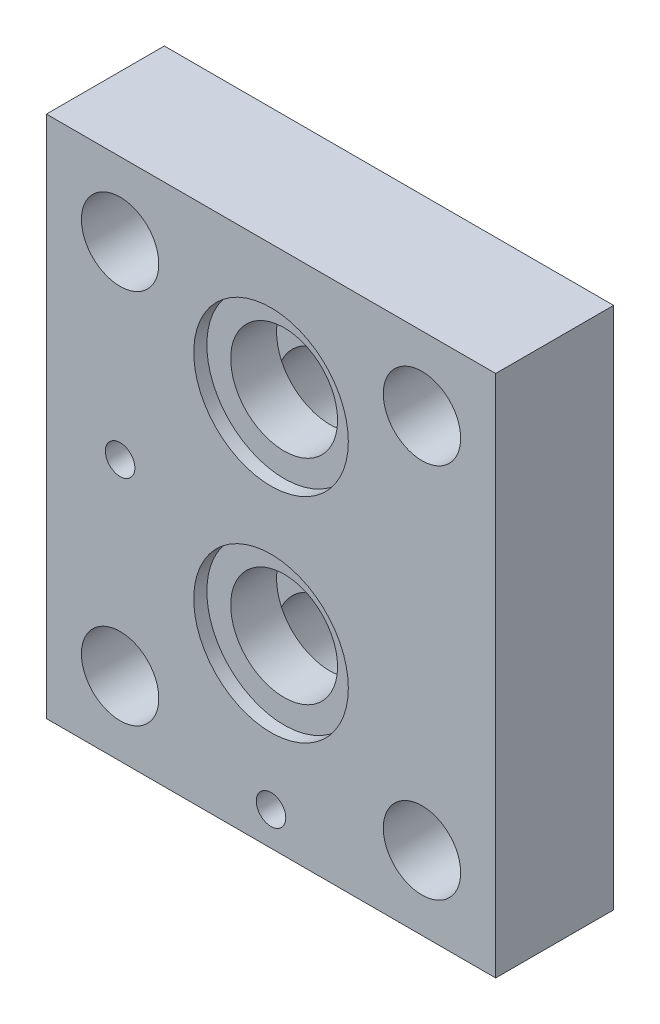
from build123d import *

# Parameters (mm, degrees)
SKETCH1_W                   = 112.776
SKETCH1_H                   = 96.774
BOSS_EXTRUDE1_DEPTH         = 12.7
F_5_8_CLEARANCE_HOLE1_D     = 16.66875
F_5_8_CLEARANCE_HOLE1_DEPTH = 25.4
F_5_8_CLEARANCE_HOLE1_TIP   = 5.007797722
F_5_8_CLEARANCE_HOLE2_D     = 16.66875
F_5_8_CLEARANCE_HOLE2_DEPTH = 25.4
F_5_8_CLEARANCE_HOLE2_TIP   = 5.007797722
CUT_EXTRUDE2_START          = -12.7
SKETCH6_R                   = 11.509375
CUT_EXTRUDE2_DEPTH          = 12.7
CUT_EXTRUDE4_START          = -12.7
SKETCH7_R                   = 11.509375
CUT_EXTRUDE4_DEPTH          = 12.7
CUT_EXTRUDE6_START          = 12.7
SKETCH8_R                   = 11.509375
CUT_EXTRUDE6_DEPTH          = 12.7
CUT_EXTRUDE8_START          = 12.7
SKETCH9_R                   = 11.509375
CUT_EXTRUDE8_DEPTH          = 12.7
CUT_EXTRUDE10_START         = 12.7
SKETCH10_R                  = 16.6497
CUT_EXTRUDE10_DEPTH         = 2.8194
CUT_EXTRUDE12_START         = 12.7
SKETCH11_R                  = 16.6497
CUT_EXTRUDE12_DEPTH         = 2.8194
F_1_4_CLEARANCE_HOLE2_D     = 7.14375
F_1_4_CLEARANCE_HOLE2_DEPTH = 7.874
F_1_4_CLEARANCE_HOLE2_TIP   = 2.146199024
CUT_EXTRUDE14_START         = 12.7
SKETCH16_R                  = 3.175
CUT_EXTRUDE14_DEPTH         = 7.874


with BuildPart() as part:
    # Sketch1 → Boss-Extrude1 (new, symmetric)
    with BuildSketch(Plane(origin=(0, 0, 0), x_dir=(0, 1, 0), z_dir=(0, 0, 1))):
        Rectangle(SKETCH1_W, SKETCH1_H)
    extrude(amount=BOSS_EXTRUDE1_DEPTH, both=True)

    # 5/8 Clearance Hole1
    with Locations(Plane(origin=(0, 0, -12.7), x_dir=(-1, 0, 0), z_dir=(0, 0, -1))):
        with Locations((-32.512, -40.513)):
            Hole(F_5_8_CLEARANCE_HOLE1_D / 2, depth=F_5_8_CLEARANCE_HOLE1_DEPTH)
            with Locations((0, 0, -(F_5_8_CLEARANCE_HOLE1_DEPTH + F_5_8_CLEARANCE_HOLE1_TIP / 2))):  # 118° drill point
                Cone(0, F_5_8_CLEARANCE_HOLE1_D / 2, F_5_8_CLEARANCE_HOLE1_TIP, mode=Mode.SUBTRACT)

    # 5/8 Clearance Hole2
    with Locations(Plane(origin=(0, 0, -12.7), x_dir=(-1, 0, 0), z_dir=(0, 0, -1))):
        with Locations((-32.512, 40.513), (32.512, -40.513), (32.512, 40.513)):
            Hole(F_5_8_CLEARANCE_HOLE2_D / 2, depth=F_5_8_CLEARANCE_HOLE2_DEPTH)
            with Locations((0, 0, -(F_5_8_CLEARANCE_HOLE2_DEPTH + F_5_8_CLEARANCE_HOLE2_TIP / 2))):  # 118° drill point
                Cone(0, F_5_8_CLEARANCE_HOLE2_D / 2, F_5_8_CLEARANCE_HOLE2_TIP, mode=Mode.SUBTRACT)

    # Sketch6 → Cut-Extrude2 (cut)
    with BuildSketch(Plane(origin=(0, 0, 0), x_dir=(0, 1, 0), z_dir=(0, 0, 1)).offset(CUT_EXTRUDE2_START)):
        with Locations((-27.813, 0)):
            Circle(SKETCH6_R)
    extrude(amount=CUT_EXTRUDE2_DEPTH, mode=Mode.SUBTRACT)

    # Sketch7 → Cut-Extrude4 (cut)
    with BuildSketch(Plane(origin=(0, 0, 0), x_dir=(0, 1, 0), z_dir=(0, 0, 1)).offset(CUT_EXTRUDE4_START)):
        with Locations((18.161, 0)):
            Circle(SKETCH7_R)
    extrude(amount=CUT_EXTRUDE4_DEPTH, mode=Mode.SUBTRACT)

    # Sketch8 → Cut-Extrude6 (cut)
    with BuildSketch(Plane(origin=(0, 0, 0), x_dir=(0, 1, 0), z_dir=(0, 0, 1)).offset(CUT_EXTRUDE6_START)):
        with Locations((-18.161, 0)):
            Circle(SKETCH8_R)
    extrude(amount=-CUT_EXTRUDE6_DEPTH, mode=Mode.SUBTRACT)

    # Sketch9 → Cut-Extrude8 (cut)
    with BuildSketch(Plane(origin=(0, 0, 0), x_dir=(0, 1, 0), z_dir=(0, 0, 1)).offset(CUT_EXTRUDE8_START)):
        with Locations((27.813, 0)):
            Circle(SKETCH9_R)
    extrude(amount=-CUT_EXTRUDE8_DEPTH, mode=Mode.SUBTRACT)

    # Sketch10 → Cut-Extrude10 (cut)
    with BuildSketch(Plane(origin=(0, 0, 0), x_dir=(0, 1, 0), z_dir=(0, 0, 1)).offset(CUT_EXTRUDE10_START)):
        with Locations((-18.161, 0)):
            Circle(SKETCH10_R)
    extrude(amount=-CUT_EXTRUDE10_DEPTH, mode=Mode.SUBTRACT)

    # Sketch11 → Cut-Extrude12 (cut)
    with BuildSketch(Plane(origin=(0, 0, 0), x_dir=(0, 1, 0), z_dir=(0, 0, 1)).offset(CUT_EXTRUDE12_START)):
        with Locations((27.813, 0)):
            Circle(SKETCH11_R)
    extrude(amount=-CUT_EXTRUDE12_DEPTH, mode=Mode.SUBTRACT)

    # 1/4 Clearance Hole2
    with Locations(Plane(origin=(0, 0, -12.7), x_dir=(-1, 0, 0), z_dir=(0, 0, -1))):
        with Locations((0, 49.149), (-32.512, 0.127)):
            Hole(F_1_4_CLEARANCE_HOLE2_D / 2, depth=F_1_4_CLEARANCE_HOLE2_DEPTH)
            with Locations((0, 0, -(F_1_4_CLEARANCE_HOLE2_DEPTH + F_1_4_CLEARANCE_HOLE2_TIP / 2))):  # 118° drill point
                Cone(0, F_1_4_CLEARANCE_HOLE2_D / 2, F_1_4_CLEARANCE_HOLE2_TIP, mode=Mode.SUBTRACT)

    # Sketch16 → Cut-Extrude14 (cut)
    with BuildSketch(Plane(origin=(0, 0, 0), x_dir=(0, 1, 0), z_dir=(0, 0, 1)).offset(CUT_EXTRUDE14_START)):
        with Locations((-49.149, 0)):
            Circle(SKETCH16_R)
        with Locations((-0.127, 32.512)):
            Circle(SKETCH16_R)
    extrude(amount=-CUT_EXTRUDE14_DEPTH, mode=Mode.SUBTRACT)


solid = part.part
